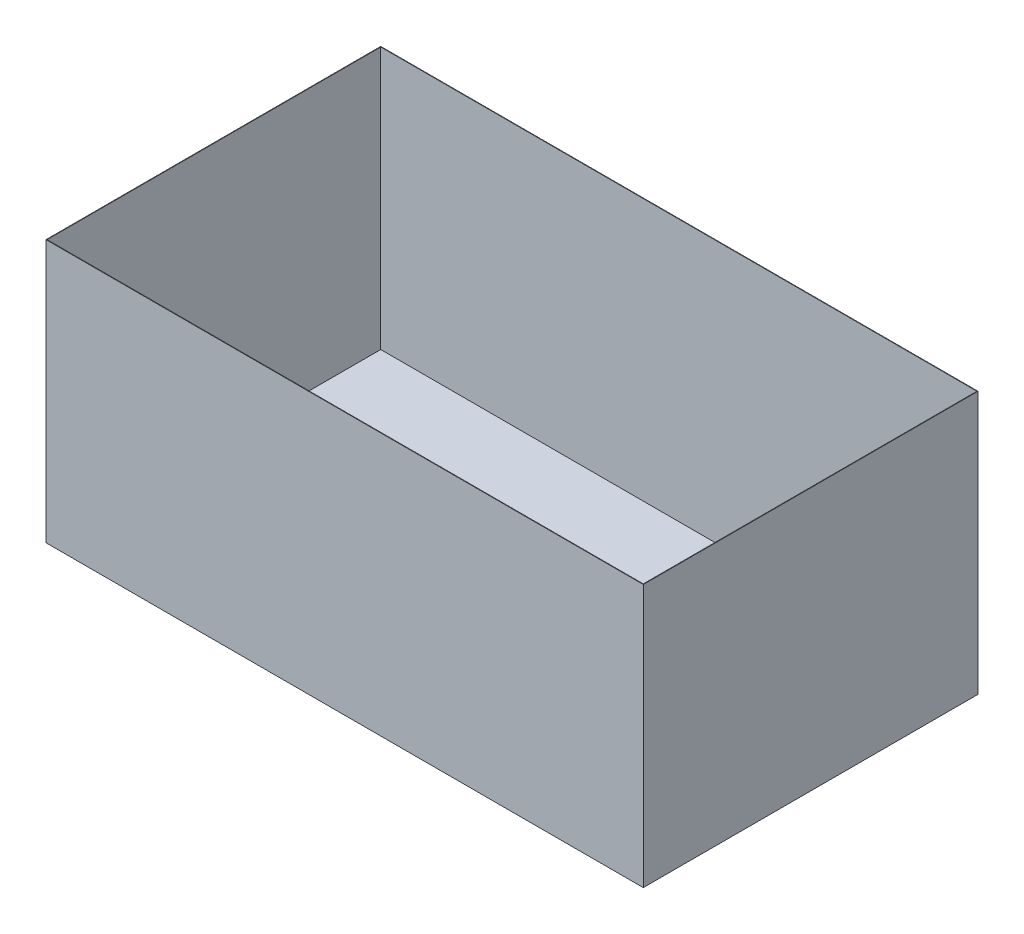
from build123d import *

# Parameters (mm, degrees)
SKETCH1_W           = 1295.4
SKETCH1_H           = 1016
BOSS_EXTRUDE1_DEPTH = 2311.4
SKETCH2_W           = 2307.39999784
SKETCH2_H           = 1291.39999784
CUT_EXTRUDE1_DEPTH  = 1013.99999892
SCALE1_SCALE        = 2.54


with BuildPart() as part:
    # Sketch1 → Boss-Extrude1 (new body)
    with BuildSketch(Plane(origin=(0, 0, 0), x_dir=(0, 0, -1), z_dir=(1, 0, 0))):
        with Locations((647.7, 508)):
            Rectangle(SKETCH1_W, SKETCH1_H)
    extrude(amount=-BOSS_EXTRUDE1_DEPTH)

    # Sketch2 → Cut-Extrude1 (cut)
    with BuildSketch(Plane(origin=(0, 1016, 0), x_dir=(1, 0, 0), z_dir=(0, 1, 0))):
        with Locations((-1155.7, 647.7)):
            Rectangle(SKETCH2_W, SKETCH2_H)
    extrude(amount=-CUT_EXTRUDE1_DEPTH, mode=Mode.SUBTRACT)


with BuildPart() as part_1:
    # Scale1: scaled about (-1155.7, 361.335054586, -647.7)
    add(part.part.scale(SCALE1_SCALE).moved(Location((1779.778, -556.455984062, 997.458))))


solid = part_1.part
